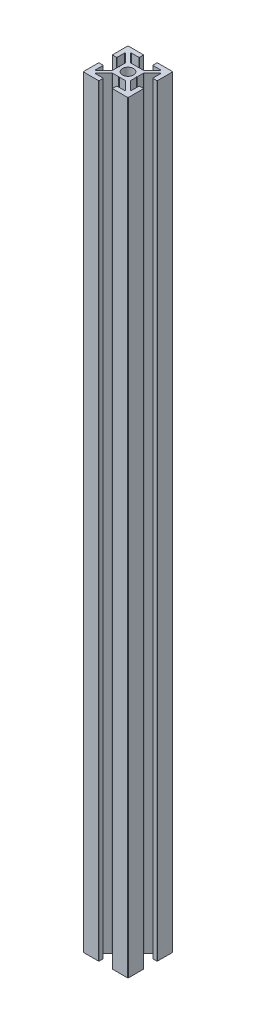
from build123d import *

# Parameters (mm, degrees)
SKETCH1_R           = 2.5
BOSS_EXTRUDE1_DEPTH = 340


with BuildPart() as part:
    # Sketch1 → Boss-Extrude1 (new body)
    with BuildSketch(Plane(origin=(0, 0, 0), x_dir=(1, 0, 0), z_dir=(0, 1, 0))):
        with BuildLine():
            Line((-2.997918472, 4.058578644), (-6.597918472, 7.658578644))
            ThreePointArc((-6.597918472, 7.658578644), (-6.621415508, 7.686854412), (-6.639339828, 7.718953455))
            ThreePointArc((-6.639339828, 7.718953455), (-6.656497116, 7.8), (-6.639339828, 7.881046545))
            ThreePointArc((-6.639339828, 7.881046545), (-6.565562901, 7.967644429), (-6.456497116, 8))
            Line((-6.456497116, 8), (-3.2, 8))
            ThreePointArc((-3.2, 8), (-3.058578644, 8.058578644), (-3, 8.2))
            Line((-3, 8.2), (-3, 9.8))
            ThreePointArc((-3, 9.8), (-3.058578644, 9.941421356), (-3.2, 10))
            Line((-3.2, 10), (-9.8, 10))
            ThreePointArc((-9.8, 10), (-9.941421356, 9.941421356), (-10, 9.8))
            Line((-10, 9.8), (-10, 3.2))
            ThreePointArc((-10, 3.2), (-9.941421356, 3.058578644), (-9.8, 3))
            Line((-9.8, 3), (-8.2, 3))
            ThreePointArc((-8.2, 3), (-8.058578644, 3.058578644), (-8, 3.2))
            Line((-8, 3.2), (-8, 6.456497116))
            ThreePointArc((-8, 6.456497116), (-7.967644429, 6.565562901), (-7.881046545, 6.639339828))
            ThreePointArc((-7.881046545, 6.639339828), (-7.8, 6.656497116), (-7.718953455, 6.639339828))
            ThreePointArc((-7.718953455, 6.639339828), (-7.686854412, 6.621415508), (-7.658578644, 6.597918472))
            Line((-7.658578644, 6.597918472), (-4.058578644, 2.997918472))
            ThreePointArc((-4.058578644, 2.997918472), (-4.015224093, 2.933033802), (-4, 2.856497116))
            Line((-4, 2.856497116), (-4, 0.130901699))
            ThreePointArc((-4, 0.130901699), (-3.99253254, 0.104615144), (-3.97236068, 0.08618034))
            Line((-3.97236068, 0.08618034), (-3.8, 0))
            Line((-3.8, 0), (-3.97236068, -0.08618034))
            ThreePointArc((-3.97236068, -0.08618034), (-3.99253254, -0.104615144), (-4, -0.130901699))
            Line((-4, -0.130901699), (-4, -2.856497116))
            ThreePointArc((-4, -2.856497116), (-4.015224093, -2.933033802), (-4.058578644, -2.997918472))
            Line((-4.058578644, -2.997918472), (-7.658578644, -6.597918472))
            ThreePointArc((-7.658578644, -6.597918472), (-7.686854412, -6.621415508), (-7.718953455, -6.639339828))
            ThreePointArc((-7.718953455, -6.639339828), (-7.8, -6.656497116), (-7.881046545, -6.639339828))
            ThreePointArc((-7.881046545, -6.639339828), (-7.967644429, -6.565562901), (-8, -6.456497116))
            Line((-8, -6.456497116), (-8, -3.2))
            ThreePointArc((-8, -3.2), (-8.058578644, -3.058578644), (-8.2, -3))
            Line((-8.2, -3), (-9.8, -3))
            ThreePointArc((-9.8, -3), (-9.941421356, -3.058578644), (-10, -3.2))
            Line((-10, -3.2), (-10, -9.8))
            ThreePointArc((-10, -9.8), (-9.941421356, -9.941421356), (-9.8, -10))
            Line((-9.8, -10), (-3.2, -10))
            ThreePointArc((-3.2, -10), (-3.058578644, -9.941421356), (-3, -9.8))
            Line((-3, -9.8), (-3, -8.2))
            ThreePointArc((-3, -8.2), (-3.058578644, -8.058578644), (-3.2, -8))
            Line((-3.2, -8), (-6.456497116, -8))
            ThreePointArc((-6.456497116, -8), (-6.565562901, -7.967644429), (-6.639339828, -7.881046545))
            ThreePointArc((-6.639339828, -7.881046545), (-6.656497116, -7.8), (-6.639339828, -7.718953455))
            ThreePointArc((-6.639339828, -7.718953455), (-6.621415508, -7.686854412), (-6.597918472, -7.658578644))
            Line((-6.597918472, -7.658578644), (-2.997918472, -4.058578644))
            ThreePointArc((-2.997918472, -4.058578644), (-2.933033802, -4.015224093), (-2.856497116, -4))
            Line((-2.856497116, -4), (-0.211803399, -4))
            ThreePointArc((-0.211803399, -4), (-0.200315753, -3.998662449), (-0.189442719, -3.99472136))
            Line((-0.189442719, -3.99472136), (0, -3.9))
            Line((0, -3.9), (0.189442719, -3.99472136))
            ThreePointArc((0.189442719, -3.99472136), (0.200315753, -3.998662449), (0.211803399, -4))
            Line((0.211803399, -4), (2.856497116, -4))
            ThreePointArc((2.856497116, -4), (2.933033802, -4.015224093), (2.997918472, -4.058578644))
            Line((2.997918472, -4.058578644), (6.597918472, -7.658578644))
            ThreePointArc((6.597918472, -7.658578644), (6.621415508, -7.686854412), (6.639339828, -7.718953455))
            ThreePointArc((6.639339828, -7.718953455), (6.656497116, -7.8), (6.639339828, -7.881046545))
            ThreePointArc((6.639339828, -7.881046545), (6.565562901, -7.967644429), (6.456497116, -8))
            Line((6.456497116, -8), (3.2, -8))
            ThreePointArc((3.2, -8), (3.058578644, -8.058578644), (3, -8.2))
            Line((3, -8.2), (3, -9.8))
            ThreePointArc((3, -9.8), (3.058578644, -9.941421356), (3.2, -10))
            Line((3.2, -10), (9.8, -10))
            ThreePointArc((9.8, -10), (9.941421356, -9.941421356), (10, -9.8))
            Line((10, -9.8), (10, -3.2))
            ThreePointArc((10, -3.2), (9.941421356, -3.058578644), (9.8, -3))
            Line((9.8, -3), (8.2, -3))
            ThreePointArc((8.2, -3), (8.058578644, -3.058578644), (8, -3.2))
            Line((8, -3.2), (8, -6.456497116))
            ThreePointArc((8, -6.456497116), (7.967644429, -6.565562901), (7.881046545, -6.639339828))
            ThreePointArc((7.881046545, -6.639339828), (7.8, -6.656497116), (7.718953455, -6.639339828))
            ThreePointArc((7.718953455, -6.639339828), (7.686854412, -6.621415508), (7.658578644, -6.597918472))
            Line((7.658578644, -6.597918472), (4.058578644, -2.997918472))
            ThreePointArc((4.058578644, -2.997918472), (4.015224093, -2.933033802), (4, -2.856497116))
            Line((4, -2.856497116), (4, -0.130901699))
            ThreePointArc((4, -0.130901699), (3.99253254, -0.104615144), (3.97236068, -0.08618034))
            Line((3.97236068, -0.08618034), (3.8, 0))
            Line((3.8, 0), (3.97236068, 0.08618034))
            ThreePointArc((3.97236068, 0.08618034), (3.99253254, 0.104615144), (4, 0.130901699))
            Line((4, 0.130901699), (4, 2.856497116))
            ThreePointArc((4, 2.856497116), (4.015224093, 2.933033802), (4.058578644, 2.997918472))
            Line((4.058578644, 2.997918472), (7.658578644, 6.597918472))
            ThreePointArc((7.658578644, 6.597918472), (7.686854412, 6.621415508), (7.718953455, 6.639339828))
            ThreePointArc((7.718953455, 6.639339828), (7.8, 6.656497116), (7.881046545, 6.639339828))
            ThreePointArc((7.881046545, 6.639339828), (7.967644429, 6.565562901), (8, 6.456497116))
            Line((8, 6.456497116), (8, 3.2))
            ThreePointArc((8, 3.2), (8.058578644, 3.058578644), (8.2, 3))
            Line((8.2, 3), (9.8, 3))
            ThreePointArc((9.8, 3), (9.941421356, 3.058578644), (10, 3.2))
            Line((10, 3.2), (10, 9.8))
            ThreePointArc((10, 9.8), (9.941421356, 9.941421356), (9.8, 10))
            Line((9.8, 10), (3.2, 10))
            ThreePointArc((3.2, 10), (3.058578644, 9.941421356), (3, 9.8))
            Line((3, 9.8), (3, 8.2))
            ThreePointArc((3, 8.2), (3.058578644, 8.058578644), (3.2, 8))
            Line((3.2, 8), (6.456497116, 8))
            ThreePointArc((6.456497116, 8), (6.565562901, 7.967644429), (6.639339828, 7.881046545))
            ThreePointArc((6.639339828, 7.881046545), (6.656497116, 7.8), (6.639339828, 7.718953455))
            ThreePointArc((6.639339828, 7.718953455), (6.621415508, 7.686854412), (6.597918472, 7.658578644))
            Line((6.597918472, 7.658578644), (2.997918472, 4.058578644))
            ThreePointArc((2.997918472, 4.058578644), (2.933033802, 4.015224093), (2.856497116, 4))
            Line((2.856497116, 4), (0.211803399, 4))
            ThreePointArc((0.211803399, 4), (0.200315753, 3.998662449), (0.189442719, 3.99472136))
            Line((0.189442719, 3.99472136), (0, 3.9))
            Line((0, 3.9), (-0.189442719, 3.99472136))
            ThreePointArc((-0.189442719, 3.99472136), (-0.200315753, 3.998662449), (-0.211803399, 4))
            Line((-0.211803399, 4), (-2.856497116, 4))
            ThreePointArc((-2.856497116, 4), (-2.933033802, 4.015224093), (-2.997918472, 4.058578644))
        make_face()
        Circle(SKETCH1_R, mode=Mode.SUBTRACT)
    extrude(amount=BOSS_EXTRUDE1_DEPTH)


solid = part.part
